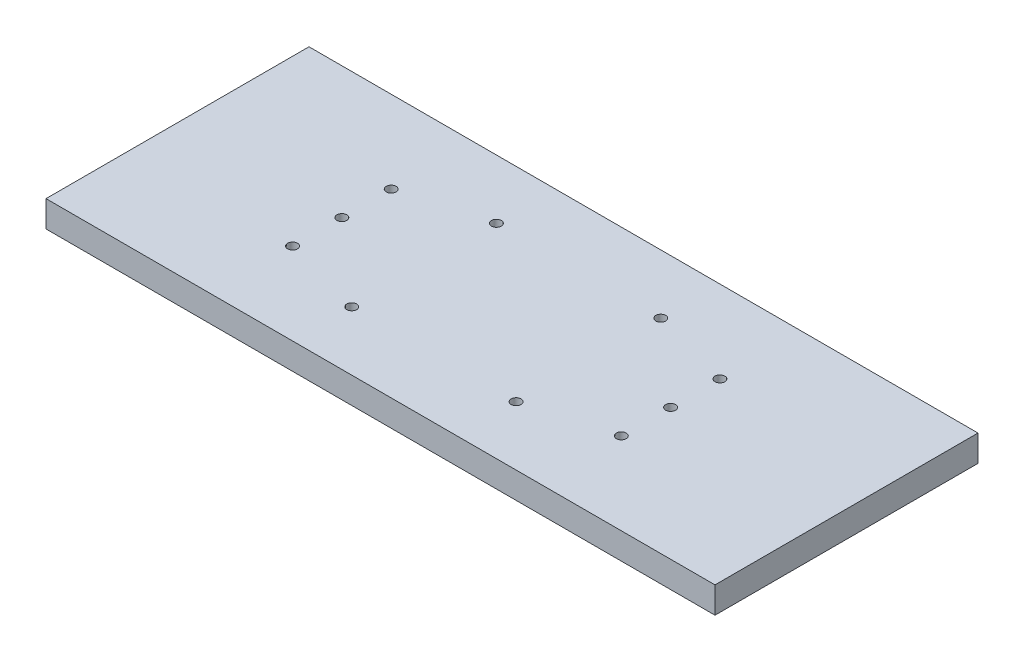
from build123d import *

# Parameters (mm, degrees)
SKETCH1_W           = 407
SKETCH1_H           = 160
BOSS_EXTRUDE1_DEPTH = 16
SKETCH2_R           = 3
CUT_EXTRUDE1_DEPTH  = 220.244726276


with BuildPart() as part:
    # Sketch1 → Boss-Extrude1 (new body)
    with BuildSketch(Plane(origin=(0, 0, 0), x_dir=(1, 0, 0), z_dir=(0, 1, 0))):
        Rectangle(SKETCH1_W, SKETCH1_H)
    extrude(amount=BOSS_EXTRUDE1_DEPTH)

    # Sketch2 → Cut-Extrude1 (cut, through all)
    with BuildSketch(Plane(origin=(0, 16, 0), x_dir=(1, 0, 0), z_dir=(0, 1, 0))):
        with Locations(Location((-53.5, 44, 0), (0, 0, 270))):
            Circle(SKETCH2_R)
        with Locations(Location((46.5, 44, 0), (0, 0, 270))):
            Circle(SKETCH2_R)
        with Locations(Location((46.5, -44, 0), (0, 0, 90))):
            Circle(SKETCH2_R)
        with Locations(Location((-53.5, -44, 0), (0, 0, 90))):
            Circle(SKETCH2_R)
        with Locations(Location((96.5, 0, 0), (0, 0, 270))):
            Circle(SKETCH2_R)
        with Locations(Location((96.5, 30, 0), (0, 0, 270))):
            Circle(SKETCH2_R)
        with Locations(Location((96.5, -30, 0), (0, 0, 90))):
            Circle(SKETCH2_R)
        with Locations(Location((-103.5, 30, 0), (0, 0, 90))):
            Circle(SKETCH2_R)
        with Locations(Location((-103.5, 0, 0), (0, 0, 90))):
            Circle(SKETCH2_R)
        with Locations(Location((-103.5, -30, 0), (0, 0, 270))):
            Circle(SKETCH2_R)
    extrude(amount=-CUT_EXTRUDE1_DEPTH, mode=Mode.SUBTRACT)


solid = part.part
